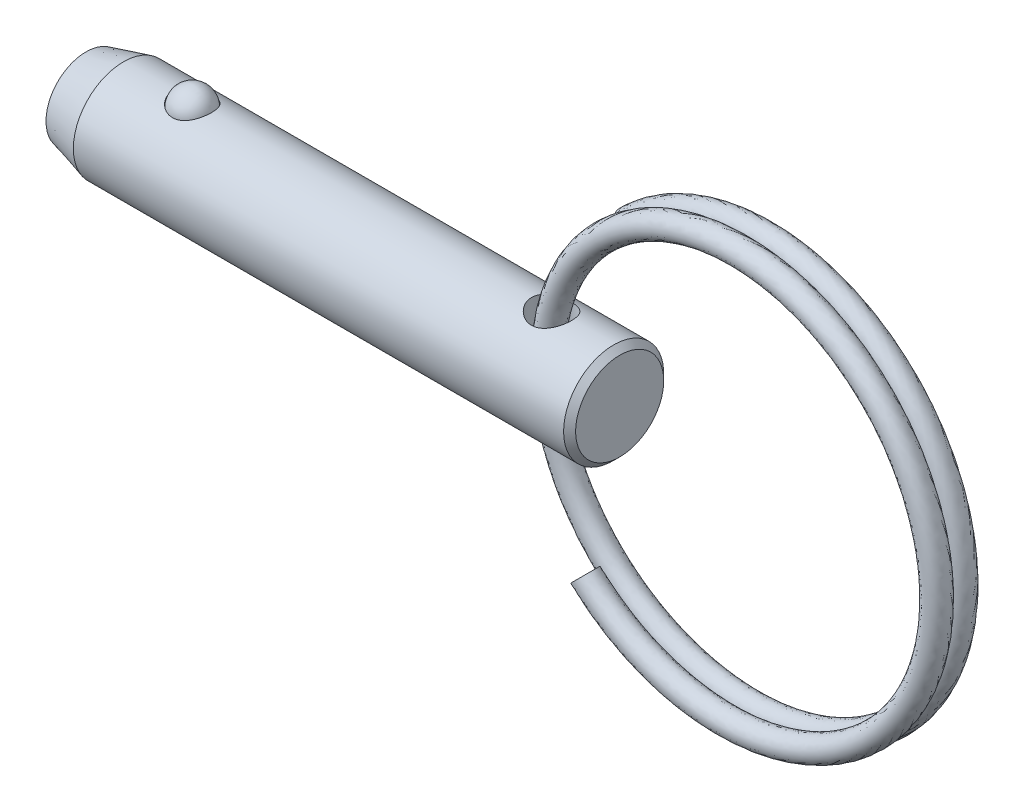
from build123d import *

# Parameters (mm, degrees)
SKETCH4_W          = 1.27
SKETCH4_H          = 6.35
SWEEP1_PITCH       = 1.5494
SWEEP1_HEIGHT      = 1.355725
SWEEP1_RADIUS      = 13.462
SKETCH6_R          = 0.762
SWEEP2_PITCH       = 1.5494
SWEEP2_HEIGHT      = 1.355725
SWEEP2_RADIUS      = 13.462
SWEEP2_START_ANGLE = -180
SKETCH6_2_R        = 0.762


with BuildPart() as part:
    # Sketch1 → Revolve1 (revolve)
    with BuildSketch(Plane.XY, mode=Mode.PRIVATE) as revolve1_sk:
        Polygon((5.588, 2.794), (5.207, 3.175), (-25.874947737, 3.175), (-28.2448, 2.54), (-28.2448, 0), (5.588, 0), align=None)
    revolve(revolve1_sk.sketch.rotate(Axis((5.588, 0, 0), (1, 0, 0)), 90), axis=Axis((5.588, 0, 0), (1, 0, 0)))

    # Sketch2 → Cut-Revolve1 (revolve, cut)
    with BuildSketch(Plane.XY):
        with BuildLine():
            Line((-20.252982051, 2.8575), (-22.767582051, 2.8575))
            ThreePointArc((-22.767582051, 2.8575), (-21.510282051, 4.1148), (-20.252982051, 2.8575))
        make_face()
    revolve(axis=Axis((-20.252982051, 2.8575, 0), (1, 0, 0)), mode=Mode.SUBTRACT)

    # Sketch4 → Cut-Revolve2 (revolve, cut)
    with BuildSketch(Plane.XY, mode=Mode.PRIVATE) as cut_revolve2_sk:
        with Locations((1.905, 0)):
            Rectangle(SKETCH4_W, SKETCH4_H)
    revolve(cut_revolve2_sk.sketch.rotate(Axis((1.27, -3.175, 0), (0, 1, 0)), 90), axis=Axis((1.27, -3.175, 0), (0, 1, 0)), mode=Mode.SUBTRACT)


with BuildPart() as body_2:
    # Sketch3 → Revolve2 (revolve)
    with BuildSketch(Plane.XY):
        with BuildLine():
            Line((-20.278382051, 2.8575), (-22.742182051, 2.8575))
            ThreePointArc((-22.742182051, 2.8575), (-21.510282051, 4.0894), (-20.278382051, 2.8575))
        make_face()
    revolve(axis=Axis((-20.278382051, 2.8575, 0), (1, 0, 0)))


with BuildPart() as body_3:
    # Sweep1: sweep along a helix
    with BuildLine() as sweep1_path:
        Helix(SWEEP1_PITCH, SWEEP1_HEIGHT, SWEEP1_RADIUS, center=(13.755025091, 0, 0), direction=(0, 0, -1), lefthand=True)
    # Sketch6 → Sweep1 (sweep)
    with BuildSketch(Plane(origin=(114.003847968, 0, 0), x_dir=(0, 0, -1), z_dir=(0, 1, 0))):
        with Locations((0, 112.948822877)):
            Circle(SKETCH6_R)
    sweep(path=sweep1_path.line, is_frenet=True)

    # Sweep2: sweep along a helix
    with BuildLine() as sweep2_path:
        add(Helix(SWEEP2_PITCH, SWEEP2_HEIGHT, SWEEP2_RADIUS, center=(13.755025091, 0, 0), direction=(0, 0, 1), lefthand=True, mode=Mode.PRIVATE).rotate(Axis((13.755025091, 0, 0), (0, 0, 1)), SWEEP2_START_ANGLE))
    # Sketch6<2> → Sweep2 (sweep)
    with BuildSketch(Plane(origin=(114.003847968, 0, 0), x_dir=(0, 0, -1), z_dir=(0, 1, 0))):
        with Locations((0, 112.948822877)):
            Circle(SKETCH6_2_R)
    sweep(path=sweep2_path.line, is_frenet=True)


solid = Compound([part.part, body_2.part, body_3.part])
